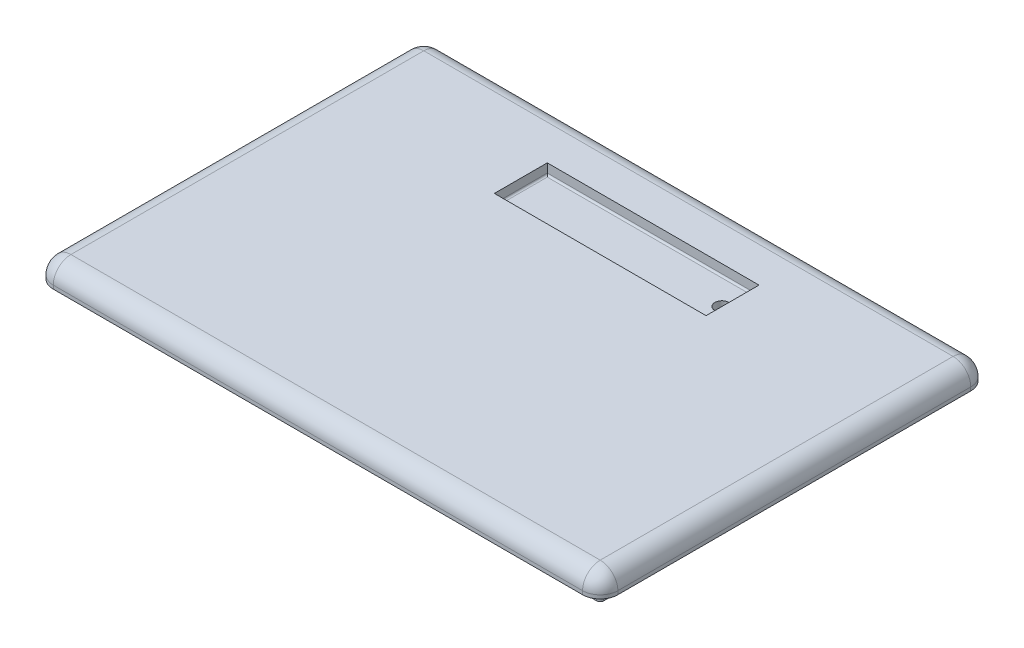
from build123d import *

# Parameters (mm, degrees)
SKETCH1_W           = 160
SKETCH1_H           = 110
BOSS_EXTRUDE1_DEPTH = 6
FILLET1_R           = 5
SKETCH2_W           = 149
SKETCH2_H           = 99
SKETCH2_W_2         = 143
SKETCH2_H_2         = 93
EXTRUDE_THIN1_DEPTH = 5
FILLET2_R           = 3
FILLET3_R           = 1
CUT_REVOLVE1_ANGLE  = 90
SKETCH5_W           = 60
SKETCH5_H           = 15
CUT_EXTRUDE1_DEPTH  = 3
FILLET4_R           = 0.5
SKETCH6_R           = 2
CUT_EXTRUDE2_DEPTH  = 5
FILLET5_R           = 1


with BuildPart() as part:
    # Sketch1 → Boss-Extrude1 (new body)
    with BuildSketch(Plane(origin=(0, 0, 0), x_dir=(1, 0, 0), z_dir=(0, 1, 0))):
        Rectangle(SKETCH1_W, SKETCH1_H)
    extrude(amount=BOSS_EXTRUDE1_DEPTH)

    # Fillet1
    fillet1_edges = [part.edges().sort_by_distance(p)[0] for p in [
        (-80, 6, 0),
        (0, 6, 55),
        (80, 6, 0),
        (80, 3, 55),
        (-80, 3, 55),
        (-80, 3, -55),
        (80, 3, -55),
        (0, 6, -55),
    ]]
    fillet(fillet1_edges, radius=FILLET1_R)

    # Sketch2 → Extrude-Thin1 (add)
    with BuildSketch(Plane.XZ):
        Rectangle(SKETCH2_W, SKETCH2_H)
        Rectangle(SKETCH2_W_2, SKETCH2_H_2, mode=Mode.SUBTRACT)
    extrude(amount=EXTRUDE_THIN1_DEPTH)

    # Fillet2
    fillet2_edges = [part.edges().sort_by_distance(p)[0] for p in [
        (71.5, 0, 0),
        (0, 0, 46.5),
        (-71.5, 0, 0),
        (0, 0, -46.5),
    ]]
    fillet(fillet2_edges, radius=FILLET2_R)

    # Fillet3
    fillet3_edges = [part.edges().sort_by_distance(p)[0] for p in [
        (71.5, -5, 0),
        (0, -5, 46.5),
        (-71.5, -5, 0),
        (0, -5, -46.5),
    ]]
    fillet(fillet3_edges, radius=FILLET3_R)

    # Sketch3 → Cut-Revolve1 (revolve, cut)
    with BuildSketch(Plane.ZY.offset(80)):
        with BuildLine():
            Line((-8, 0), (8, 0))
            ThreePointArc((8, 0), (7.121320344, 2.121320344), (5, 3))
            Line((5, 3), (-5.000000645, 3))
            ThreePointArc((-5.000000645, 3), (-7.121320532, 2.121319887), (-8, 0))
        make_face()
    revolve(axis=Axis((-80, 0, -8), (0, 0, -1)), revolution_arc=CUT_REVOLVE1_ANGLE, mode=Mode.SUBTRACT)

    # Sketch5 → Cut-Extrude1 (cut)
    with BuildSketch(Plane(origin=(0, 6, 0), x_dir=(1, 0, 0), z_dir=(0, 1, 0))):
        with Locations((0, 32.5)):
            Rectangle(SKETCH5_W, SKETCH5_H)
    extrude(amount=-CUT_EXTRUDE1_DEPTH, mode=Mode.SUBTRACT)

    # Fillet4
    fillet4_edges = [part.edges().sort_by_distance(p)[0] for p in [
        (30, 3, -32.5),
        (0, 3, -25),
        (-30, 3, -32.5),
        (0, 3, -40),
    ]]
    fillet(fillet4_edges, radius=FILLET4_R)

    # Sketch6 → Cut-Extrude2 (cut)
    with BuildSketch(Plane(origin=(0, 3, 0), x_dir=(1, 0, 0), z_dir=(0, 1, 0))):
        with Locations(Location((27, 32.5, 0), (0, 0, 270))):
            Circle(SKETCH6_R)
    extrude(amount=-CUT_EXTRUDE2_DEPTH, mode=Mode.SUBTRACT)

    # Fillet5
    fillet5_edges = [part.edges().sort_by_distance(p)[0] for p in [
        (74.5, -2.5, -49.5),
        (74.5, -2.5, 49.5),
        (-74.5, -2.5, 49.5),
        (-74.5, -2.5, -49.5),
    ]]
    fillet(fillet5_edges, radius=FILLET5_R)


solid = part.part
